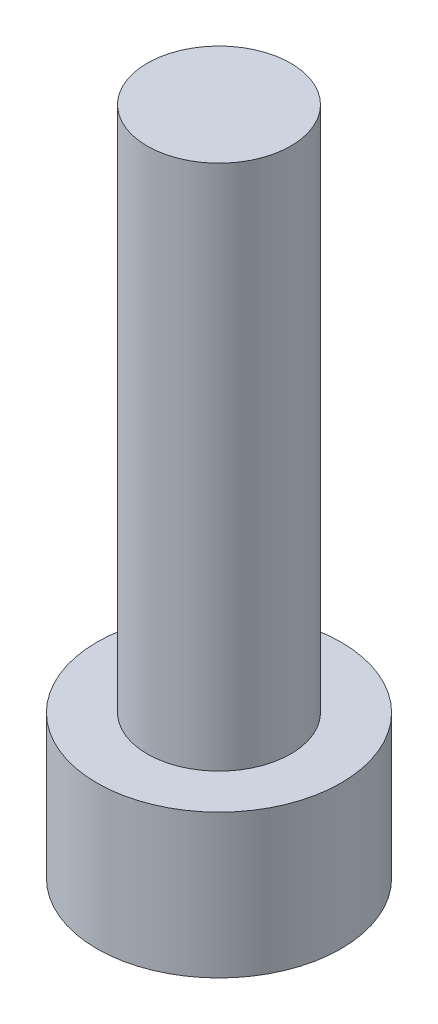
from build123d import *

# Parameters (mm, degrees)
SKETCH_1_R          = 5.1
EXTRUDE_1_DEPTH     = 6
SKETCH_2_R          = 3
EXTRUDE_2_DEPTH     = 22
CUT_EXTRUDE_1_DEPTH = 3


with BuildPart() as part:
    # 草图1 → 凸台-拉伸1 (new body)
    with BuildSketch(Plane(origin=(0, 0, 0), x_dir=(1, 0, 0), z_dir=(0, 1, 0))):
        with Locations(Location((0, 0, 0), (0, 0, 270))):
            Circle(SKETCH_1_R)
    extrude(amount=EXTRUDE_1_DEPTH)

    # 草图2 → 凸台-拉伸2 (add)
    with BuildSketch(Plane(origin=(0, 6, 0), x_dir=(1, 0, 0), z_dir=(0, 1, 0))):
        with Locations(Location((0, 0, 0), (0, 0, 270))):
            Circle(SKETCH_2_R)
    extrude(amount=EXTRUDE_2_DEPTH)

    # 草图3 → 切除-拉伸1 (cut)
    with BuildSketch(Plane.XZ):
        Polygon((2.357121757, -1.666526435), (2.621815107, 1.208064104), (0.26469335, 2.874590538), (-2.357121757, 1.666526435), (-2.621815107, -1.208064104), (-0.26469335, -2.874590538), align=None)
    extrude(amount=-CUT_EXTRUDE_1_DEPTH, mode=Mode.SUBTRACT)


solid = part.part
